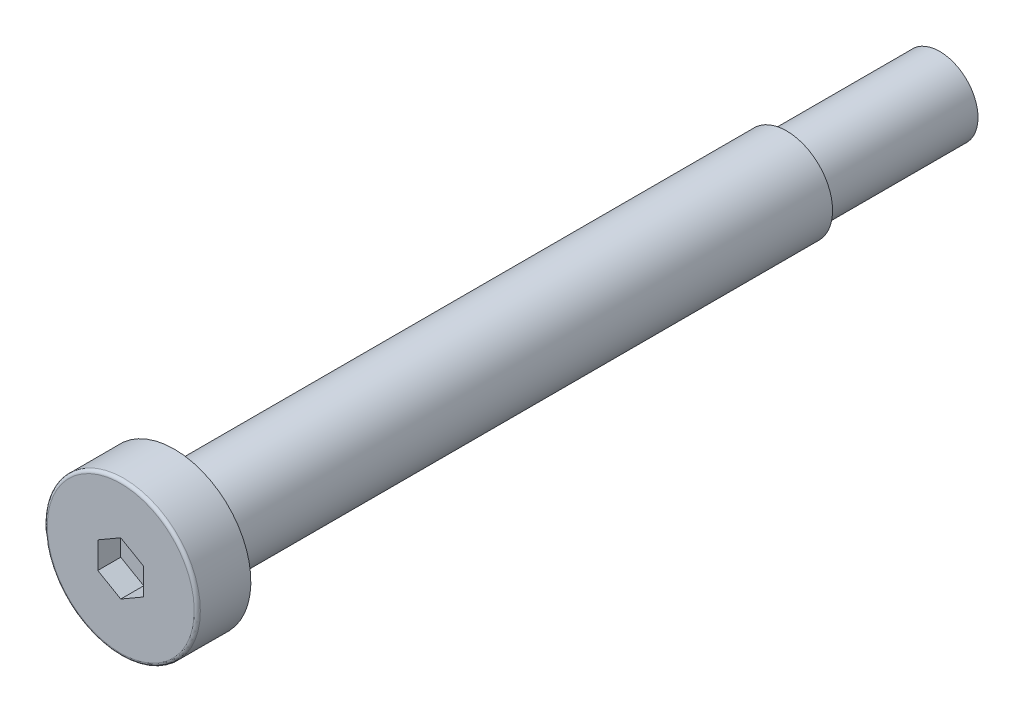
from build123d import *

# Parameters (mm, degrees)
CUT_EXTRUDE_1_DEPTH = 1.5
FILLET_1_R          = 0.2


with BuildPart() as part:
    # 草图1 → 旋转1 (revolve)
    with BuildSketch(Plane(origin=(0, 0, 0), x_dir=(0, 0, -1), z_dir=(1, 0, 0))):
        Polygon((0, 0), (0, 5), (3.5, 5), (3.5, 3), (43.5, 3), (43.5, 2.5), (53.5, 2.5), (53.5, 0), align=None)
    revolve(axis=Axis((0, 0, -53.5), (0, 0, 1)))

    # 草图2 → 切除-拉伸1 (cut)
    with BuildSketch(Plane.XY):
        Polygon((1.5, 0.866025404), (0, 1.732050808), (-1.5, 0.866025404), (-1.5, -0.866025404), (0, -1.732050808), (1.5, -0.866025404), align=None)
    extrude(amount=-CUT_EXTRUDE_1_DEPTH, mode=Mode.SUBTRACT)

    # 圆角1
    fillet_1_edges = [part.edges().sort_by_distance(p)[0] for p in [
        (0, -5, 0),
    ]]
    fillet(fillet_1_edges, radius=FILLET_1_R)


solid = part.part
